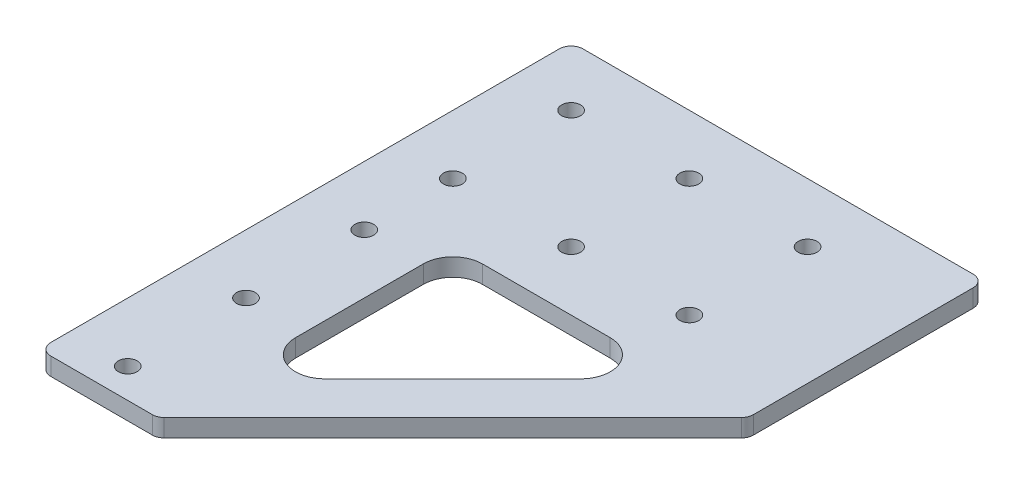
from build123d import *

# Parameters (mm, degrees)
SKETCH_1_R      = 1.6
EXTRUDE_1_DEPTH = 3
FILLET_1_R      = 2
FILLET_2_R      = 5


with BuildPart() as part:
    # 草图1 → 凸台-拉伸1 (new body)
    with BuildSketch(Plane(origin=(0, 0, 0), x_dir=(1, 0, 0), z_dir=(0, 1, 0))):
        Polygon((0, -50), (-20, -50), (-20, 40), (50, 40), (50, 0), align=None)
        with Locations(Location((-10, -5, 0), (0, 0, 270))):
            Circle(SKETCH_1_R, mode=Mode.SUBTRACT)
        with Locations(Location((-10, -25, 0), (0, 0, 270))):
            Circle(SKETCH_1_R, mode=Mode.SUBTRACT)
        with Locations(Location((-10, -45, 0), (0, 0, 270))):
            Circle(SKETCH_1_R, mode=Mode.SUBTRACT)
        with Locations(Location((-10, 10, 0), (0, 0, 270))):
            Circle(SKETCH_1_R, mode=Mode.SUBTRACT)
        with Locations(Location((-10, 30, 0), (0, 0, 270))):
            Circle(SKETCH_1_R, mode=Mode.SUBTRACT)
        with Locations(Location((10, 30, 0), (0, 0, 270))):
            Circle(SKETCH_1_R, mode=Mode.SUBTRACT)
        with Locations(Location((10, 10, 0), (0, 0, 270))):
            Circle(SKETCH_1_R, mode=Mode.SUBTRACT)
        with Locations(Location((30, 30, 0), (0, 0, 270))):
            Circle(SKETCH_1_R, mode=Mode.SUBTRACT)
        with Locations(Location((30, 10, 0), (0, 0, 270))):
            Circle(SKETCH_1_R, mode=Mode.SUBTRACT)
        Polygon((0, -38.686291501), (0, 0), (38.686291501, 0), align=None, mode=Mode.SUBTRACT)
    extrude(amount=EXTRUDE_1_DEPTH)

    # 圆角1
    fillet_1_edges = [part.edges().sort_by_distance(p)[0] for p in [
        (0, 1.5, 50),
        (-20, 1.5, 50),
        (-20, 1.5, -40),
        (50, 1.5, -40),
        (50, 1.5, 0),
    ]]
    fillet(fillet_1_edges, radius=FILLET_1_R)

    # 圆角2
    fillet_2_edges = [part.edges().sort_by_distance(p)[0] for p in [
        (38.686291501, 1.5, 0),
        (0, 1.5, 0),
        (0, 1.5, 38.686291501),
    ]]
    fillet(fillet_2_edges, radius=FILLET_2_R)


solid = part.part
